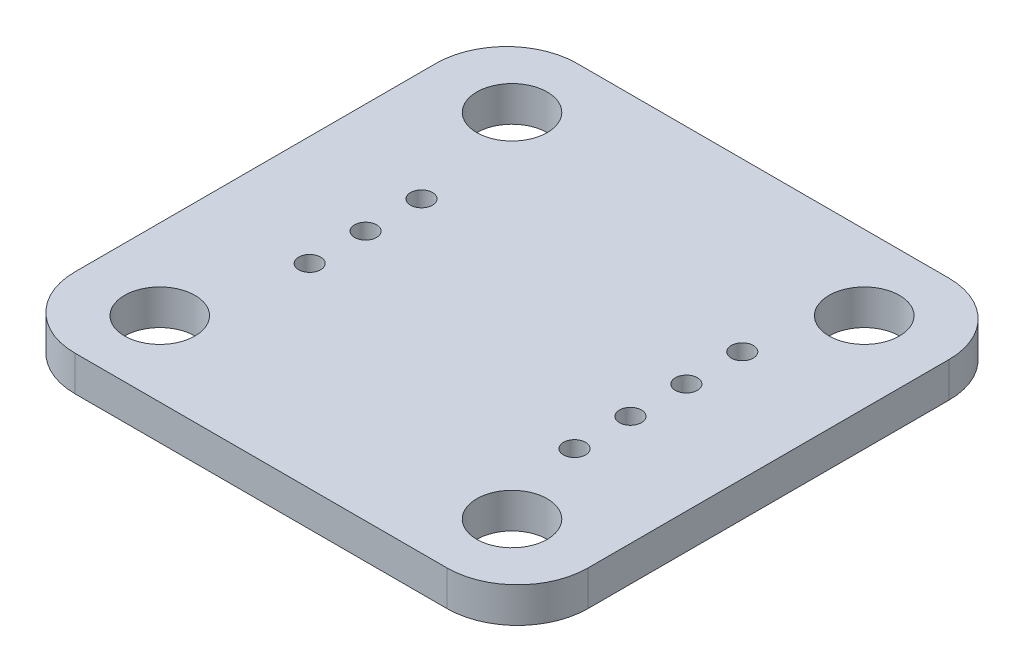
from build123d import *

# Parameters (mm, degrees)
SKETCH_1_R      = 1.6
SKETCH_1_R_2    = 0.5
EXTRUDE_1_DEPTH = 1.6


with BuildPart() as part:
    # Эскиз1 → Бобышка-Вытянуть1 (new body)
    with BuildSketch(Plane(origin=(0, 0, 0), x_dir=(1, 0, 0), z_dir=(0, 1, 0))):
        with BuildLine():
            Line((-8.45, 11.4), (8.45, 11.4))
            ThreePointArc((8.45, 11.4), (10.7127417, 10.4627417), (11.65, 8.2))
            Line((11.65, 8.2), (11.65, -8.2))
            ThreePointArc((11.65, -8.2), (10.7127417, -10.4627417), (8.45, -11.4))
            Line((8.45, -11.4), (-8.45, -11.4))
            ThreePointArc((-8.45, -11.4), (-10.7127417, -10.4627417), (-11.65, -8.2))
            Line((-11.65, -8.2), (-11.65, 8.2))
            ThreePointArc((-11.65, 8.2), (-10.7127417, 10.4627417), (-8.45, 11.4))
        make_face()
        with Locations(Location((-8, 8, 0), (0, 0, 270))):
            Circle(SKETCH_1_R, mode=Mode.SUBTRACT)
        with Locations(Location((8, 8, 0), (0, 0, 270))):
            Circle(SKETCH_1_R, mode=Mode.SUBTRACT)
        with Locations(Location((8, -8, 0), (0, 0, 270))):
            Circle(SKETCH_1_R, mode=Mode.SUBTRACT)
        with Locations(Location((-8, -8, 0), (0, 0, 270))):
            Circle(SKETCH_1_R, mode=Mode.SUBTRACT)
        with Locations(Location((-6.65, 0, 0), (0, 0, 270))):
            Circle(SKETCH_1_R_2, mode=Mode.SUBTRACT)
        with Locations(Location((-6.65, -2.54, 0), (0, 0, 270))):
            Circle(SKETCH_1_R_2, mode=Mode.SUBTRACT)
        with Locations(Location((-6.65, 2.54, 0), (0, 0, 270))):
            Circle(SKETCH_1_R_2, mode=Mode.SUBTRACT)
        with Locations(Location((6.65, 3.81, 0), (0, 0, 270))):
            Circle(SKETCH_1_R_2, mode=Mode.SUBTRACT)
        with Locations(Location((6.65, 1.27, 0), (0, 0, 270))):
            Circle(SKETCH_1_R_2, mode=Mode.SUBTRACT)
        with Locations(Location((6.65, -1.27, 0), (0, 0, 270))):
            Circle(SKETCH_1_R_2, mode=Mode.SUBTRACT)
        with Locations(Location((6.65, -3.81, 0), (0, 0, 270))):
            Circle(SKETCH_1_R_2, mode=Mode.SUBTRACT)
    extrude(amount=EXTRUDE_1_DEPTH)


solid = part.part
